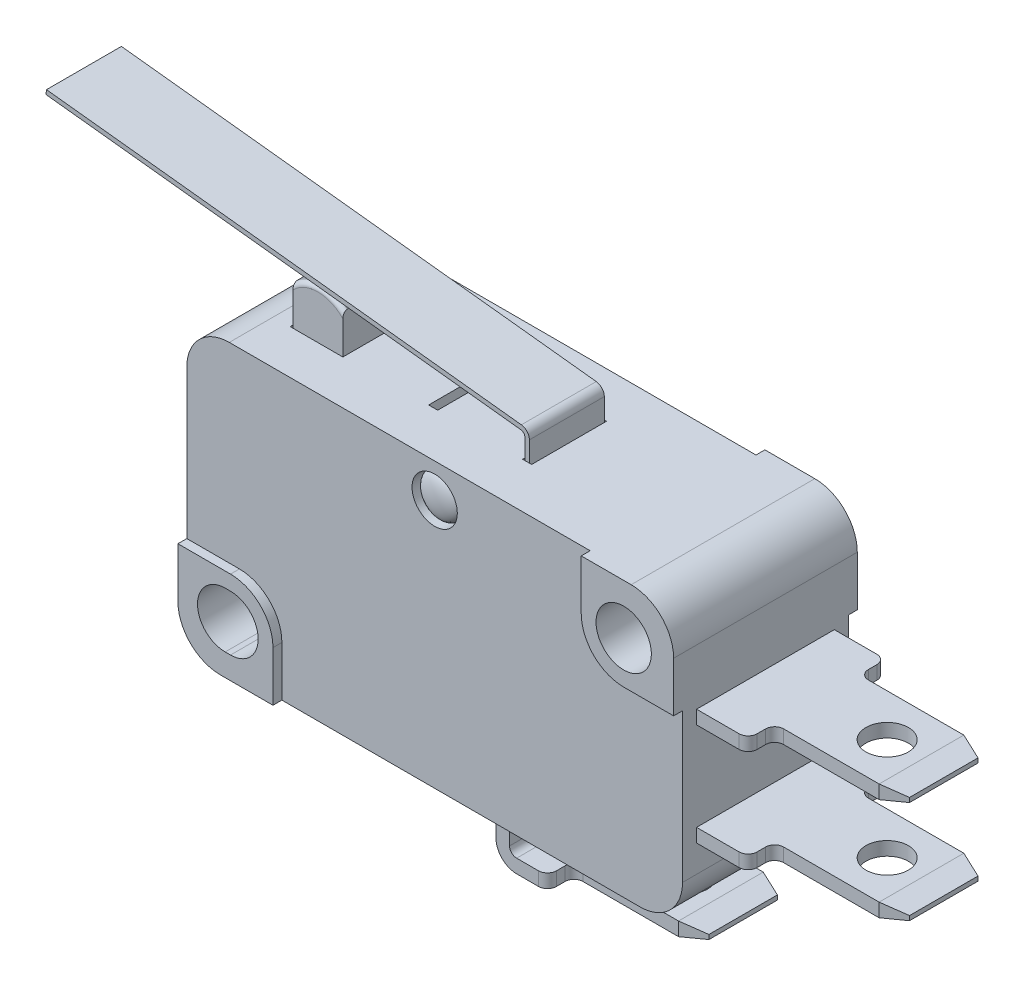
from build123d import *

# Parameters (mm, degrees)
BOSS_EXTRUDE1_DEPTH             = 5.15
BOSS_EXTRUDE1_DEPTH_BACK        = 5.15
SKETCH3_R                       = 1.55
CUT_EXTRUDE1_START              = 5.15
CUT_EXTRUDE1_DEPTH              = 0.5
CUT_EXTRUDE5_DEPTH              = 2.1
CUT_EXTRUDE5_DEPTH_BACK         = 2.1
SKETCH10_W                      = 0.508
SKETCH10_H                      = 1.5875
SKETCH8_W                       = 2.9524
SKETCH8_H                       = 0.396875
CUT_EXTRUDE4_DEPTH              = 2.1762
BOSS_EXTRUDE3_DEPTH             = 2.1
BOSS_EXTRUDE3_DEPTH_BACK        = 2.1
BOSS_EXTRUDE2_DEPTH             = 3.8625
BOSS_EXTRUDE2_2_DEPTH           = 3.8625
BOSS_EXTRUDE2_3_DEPTH           = 3.8625
BOSS_EXTRUDE9_REACH             = 28.644
BOSS_EXTRUDE9_DIRECTION_2_REACH = 28.644
FILLET5_R                       = 0.254
CUT_EXTRUDE2_DEPTH              = 28.871691861
CUT_EXTRUDE2_DEPTH_BACK         = 28.871691861
SKETCH6_OUTSIDE_W               = 61.146
SKETCH6_OUTSIDE_H               = 23.198
SKETCH6_OUTSIDE_R               = 1.190625
SKETCH7_OUTSIDE_W               = 61.146
SKETCH7_OUTSIDE_H               = 23.198
SKETCH7_OUTSIDE_R               = 1.190625
CUT_EXTRUDE3_DEPTH              = 28.871691861
SKETCH25_R                      = 1.27
CUT_EXTRUDE6_DEPTH              = 1.27
SKETCH26_R                      = 1.2065
BOSS_EXTRUDE10_DEPTH            = 0.762
DOME1_FACE_RADIUS               = 1.2065
DOME1_HEIGHT                    = 0.508


with BuildPart() as part:
    # Sketch3 → Boss-Extrude1 (new, two sides: drawn at the far end of the back side and taken through both)
    with BuildSketch(Plane.XY.offset(-BOSS_EXTRUDE1_DEPTH_BACK)):
        with BuildLine():
            Line((-11.51875, 7.95), (11.51875, 7.95))
            ThreePointArc((11.51875, 7.95), (13.202548023, 7.252548023), (13.9, 5.56875))
            Line((13.9, 5.56875), (13.9, -5.56875))
            ThreePointArc((13.9, -5.56875), (13.202548023, -7.252548023), (11.51875, -7.95))
            Line((11.51875, -7.95), (-11.51875, -7.95))
            ThreePointArc((-11.51875, -7.95), (-13.202548023, -7.252548023), (-13.9, -5.56875))
            Line((-13.9, -5.56875), (-13.9, 5.56875))
            ThreePointArc((-13.9, 5.56875), (-13.202548023, 7.252548023), (-11.51875, 7.95))
        make_face()
        with Locations(Location((11.1, 5.15, 0), (0, 0, 180))):
            Circle(SKETCH3_R, mode=Mode.SUBTRACT)
        with BuildLine():
            Line((-11.25, -3.6), (-10.95, -3.6))
            ThreePointArc((-10.95, -3.6), (-9.4, -5.15), (-10.95, -6.7))
            Line((-10.95, -6.7), (-11.25, -6.7))
            ThreePointArc((-11.25, -6.7), (-12.8, -5.15), (-11.25, -3.6))
        make_face(mode=Mode.SUBTRACT)
    extrude(amount=BOSS_EXTRUDE1_DEPTH + BOSS_EXTRUDE1_DEPTH_BACK)

    # Sketch4 → Cut-Extrude1 (cut)
    with BuildSketch(Plane.XY.offset(CUT_EXTRUDE1_START)):
        with BuildLine():
            Line((-13.9, -2.76875), (-10.95, -2.76875))
            ThreePointArc((-10.95, -2.76875), (-9.266201977, -3.466201977), (-8.56875, -5.15))
            Line((-8.56875, -5.15), (-8.56875, -7.95))
            Line((-8.56875, -7.95), (13.9, -7.95))
            Line((13.9, -7.95), (13.9, 2.76875))
            Line((13.9, 2.76875), (11.1, 2.76875))
            ThreePointArc((11.1, 2.76875), (9.416201977, 3.466201977), (8.71875, 5.15))
            Line((8.71875, 5.15), (8.71875, 7.95))
            Line((8.71875, 7.95), (-13.9, 7.95))
            Line((-13.9, 7.95), (-13.9, -2.76875))
        make_face()
    cut_extrude1 = extrude(amount=-CUT_EXTRUDE1_DEPTH, mode=Mode.SUBTRACT)

    # Mirror1: Cut-Extrude1 across plane
    add(cut_extrude1.mirror(Plane.XY), mode=Mode.SUBTRACT)

    # Sketch10 → Cut-Extrude5 (cut, two sides: drawn at the far end of the back side and taken through both)
    with BuildSketch(Plane.XY.offset(-CUT_EXTRUDE5_DEPTH_BACK)):
        with Locations((-2.63525, 7.15625)):
            Rectangle(SKETCH10_W, SKETCH10_H)
        with Locations((2.63525, 7.15625)):
            Rectangle(SKETCH10_W, SKETCH10_H)
    extrude(amount=CUT_EXTRUDE5_DEPTH + CUT_EXTRUDE5_DEPTH_BACK, mode=Mode.SUBTRACT)

    # Sketch8 → Cut-Extrude4 (cut, symmetric)
    with BuildSketch(Plane.XY):
        with Locations((-9.1, 7.7515625)):
            Rectangle(SKETCH8_W, SKETCH8_H)
    extrude(amount=CUT_EXTRUDE4_DEPTH, both=True, mode=Mode.SUBTRACT)

    # Sketch25 → Cut-Extrude6 (cut)
    with BuildSketch(Plane.XY.offset(4.65)):
        with Locations((0, 6.045)):
            Circle(SKETCH25_R)
    cut_extrude6 = extrude(amount=-CUT_EXTRUDE6_DEPTH, mode=Mode.SUBTRACT)

    # Mirror2: Cut-Extrude6 across plane
    add(cut_extrude6.mirror(Plane.XY), mode=Mode.SUBTRACT)


with BuildPart() as body_2:
    # Sketch9 → Boss-Extrude3 (new, two sides: drawn at the far end of the back side and taken through both)
    with BuildSketch(Plane.XY.offset(-BOSS_EXTRUDE3_DEPTH_BACK)):
        with BuildLine():
            Line((-10.5, 10.079506749), (-10.5, 7.553125))
            Line((-10.5, 7.553125), (-7.7, 7.553125))
            Line((-7.7, 7.553125), (-7.7, 10.079506749))
            ThreePointArc((-7.7, 10.079506749), (-9.1, 10.587506749), (-10.5, 10.079506749))
        make_face()
    extrude(amount=BOSS_EXTRUDE3_DEPTH + BOSS_EXTRUDE3_DEPTH_BACK)


with BuildPart() as body_3:
    # Sketch5 → Boss-Extrude2 (new, symmetric)
    with BuildSketch(Plane.XY):
        Polygon((13.9, 1.688), (13.9, 2.45), (22.65, 2.45), (23.9, 2.194), (23.9, 1.944), (22.65, 1.688), align=None)
    extrude(amount=BOSS_EXTRUDE2_DEPTH, both=True)


with BuildPart() as body_4:
    # Sketch5 → Boss-Extrude2 2 (new, symmetric)
    with BuildSketch(Plane.XY):
        Polygon((13.9, -3.288), (22.65, -3.288), (23.9, -3.544), (23.9, -3.794), (22.65, -4.05), (13.9, -4.05), align=None)
    extrude(amount=BOSS_EXTRUDE2_2_DEPTH, both=True)


with BuildPart() as body_5:
    # Sketch5 → Boss-Extrude2 3 (new, symmetric)
    with BuildSketch(Plane.XY):
        with BuildLine():
            Line((2.65, -7.95), (2.65, -9.433125))
            ThreePointArc((2.65, -9.433125), (2.989426629, -10.252573371), (3.808875, -10.592))
            Line((3.808875, -10.592), (11.4, -10.592))
            Line((11.4, -10.592), (12.65, -10.336))
            Line((12.65, -10.336), (12.65, -10.086))
            Line((12.65, -10.086), (11.4, -9.83))
            Line((11.4, -9.83), (3.808875, -9.83))
            ThreePointArc((3.808875, -9.83), (3.528241996, -9.713758004), (3.412, -9.433125))
            Line((3.412, -9.433125), (3.412, -7.95))
            Line((3.412, -7.95), (2.65, -7.95))
        make_face()
    extrude(amount=BOSS_EXTRUDE2_3_DEPTH, both=True)

    # Sketch7 outside → Cut-Extrude3 (cut, through all)
    # profile 1 of 2: a face of its own
    with BuildSketch(Plane(origin=(0, 0, 0), x_dir=(1, 0, 0), z_dir=(0, 1, 0))):
        with Locations((-0.224, 0)):
            Rectangle(SKETCH7_OUTSIDE_W, SKETCH7_OUTSIDE_H)
        with BuildLine():
            Line((2.65, 3.8625), (2.65, -3.8625))
            Line((2.65, -3.8625), (5.03125, -3.8625))
            ThreePointArc((5.03125, -3.8625), (5.390460245, -3.713710245), (5.53925, -3.3545))
            Line((5.53925, -3.3545), (5.53925, -2.8829))
            ThreePointArc((5.53925, -2.8829), (5.688039755, -2.523689755), (6.04725, -2.3749))
            Line((6.04725, -2.3749), (11.4, -2.3749))
            Line((11.4, -2.3749), (12.65, -1.919937207))
            Line((12.65, -1.919937207), (12.65, 1.919937207))
            Line((12.65, 1.919937207), (11.4, 2.3749))
            Line((11.4, 2.3749), (6.04725, 2.3749))
            ThreePointArc((6.04725, 2.3749), (5.688039755, 2.523689755), (5.53925, 2.8829))
            Line((5.53925, 2.8829), (5.53925, 3.3545))
            ThreePointArc((5.53925, 3.3545), (5.390460245, 3.713710245), (5.03125, 3.8625))
            Line((5.03125, 3.8625), (2.65, 3.8625))
        make_face(mode=Mode.SUBTRACT)
    # profile 2 of 2: a face of its own
    with BuildSketch(Plane(origin=(0, 0, 0), x_dir=(1, 0, 0), z_dir=(0, 1, 0))):
        with Locations(Location((9.475, 0, 0), (0, 0, 270))):
            Circle(SKETCH7_OUTSIDE_R)
    extrude(amount=-CUT_EXTRUDE3_DEPTH, mode=Mode.SUBTRACT)


with BuildPart() as body_6:

    # Boss-Extrude9: up to this face of the body (flat: up to its plane)
    boss_extrude9_end = Plane(body_2.part.faces().sort_by_distance((-9.1, 8.993855519, 2.1))[0])
    # Sketch23 → Boss-Extrude9 (new, up to the picked face)
    with BuildSketch(Plane.XY, mode=Mode.PRIVATE) as boss_extrude9_sk1:
        with BuildLine():
            Line((2.282338846, 9.334484128), (-24.34761194, 12.297557894))
            Line((-24.34761194, 12.297557894), (-24.319523094, 12.55))
            Line((-24.319523094, 12.55), (2.310427692, 9.586926234))
            ThreePointArc((2.310427692, 9.586926234), (2.632801362, 9.420808707), (2.76225, 9.082042023))
            Line((2.76225, 9.082042023), (2.76225, 6.3625))
            Line((2.76225, 6.3625), (2.50825, 6.3625))
            Line((2.50825, 6.3625), (2.50825, 9.082042023))
            ThreePointArc((2.50825, 9.082042023), (2.443525681, 9.251425365), (2.282338846, 9.334484128))
        make_face()
    boss_extrude9_tool1 = split(extrude(boss_extrude9_sk1.sketch, amount=BOSS_EXTRUDE9_REACH, mode=Mode.PRIVATE), bisect_by=boss_extrude9_end, keep=Keep.BOTH, mode=Mode.PRIVATE)
    add(boss_extrude9_tool1.solids().sort_by(Axis((2.464247, 9.269969, 0), (0, 0, 1)))[0])


    # Boss-Extrude9 direction 2: up to this face of the body (flat: up to its plane)
    boss_extrude9_direction_2_end = Plane(body_2.part.faces().sort_by_distance((-9.1, 8.993855519, -2.1))[0])
    # Sketch23 → Boss-Extrude9 direction 2 (add, up to the picked face)
    with BuildSketch(Plane.XY, mode=Mode.PRIVATE) as boss_extrude9_direction_2_sk1:
        with BuildLine():
            Line((2.282338846, 9.334484128), (-24.34761194, 12.297557894))
            Line((-24.34761194, 12.297557894), (-24.319523094, 12.55))
            Line((-24.319523094, 12.55), (2.310427692, 9.586926234))
            ThreePointArc((2.310427692, 9.586926234), (2.632801362, 9.420808707), (2.76225, 9.082042023))
            Line((2.76225, 9.082042023), (2.76225, 6.3625))
            Line((2.76225, 6.3625), (2.50825, 6.3625))
            Line((2.50825, 6.3625), (2.50825, 9.082042023))
            ThreePointArc((2.50825, 9.082042023), (2.443525681, 9.251425365), (2.282338846, 9.334484128))
        make_face()
    boss_extrude9_direction_2_tool1 = split(extrude(boss_extrude9_direction_2_sk1.sketch, amount=-BOSS_EXTRUDE9_DIRECTION_2_REACH, mode=Mode.PRIVATE), bisect_by=boss_extrude9_direction_2_end, keep=Keep.BOTH, mode=Mode.PRIVATE)
    add(boss_extrude9_direction_2_tool1.solids().sort_by(Axis((2.464247, 9.269969, 0), (0, 0, -1)))[0])


with BuildPart() as body_2_1:
    add(body_2.part)

    # Fillet5
    fillet5_edges = [body_2_1.edges().sort_by_distance(p)[0] for p in [
        (-9.1, 10.587506749, -2.1),
        (-9.1, 10.587506749, 2.1),
    ]]
    fillet(fillet5_edges, radius=FILLET5_R)


with BuildPart() as cut_extrude2_tool:
    # Sketch6 outside → Cut-Extrude2 (new, two sides: drawn at the far end of the back side and taken through both)
    # profile 1 of 2: a face of its own
    with BuildSketch(Plane(origin=(0, 0, 0), x_dir=(1, 0, 0), z_dir=(0, 1, 0)).offset(-CUT_EXTRUDE2_DEPTH_BACK)):
        with Locations((-0.224, 0)):
            Rectangle(SKETCH6_OUTSIDE_W, SKETCH6_OUTSIDE_H)
        with BuildLine():
            Line((13.9, 3.8625), (13.9, -3.8625))
            Line((13.9, -3.8625), (16.28125, -3.8625))
            ThreePointArc((16.28125, -3.8625), (16.640460245, -3.713710245), (16.78925, -3.3545))
            Line((16.78925, -3.3545), (16.78925, -2.8829))
            ThreePointArc((16.78925, -2.8829), (16.938039755, -2.523689755), (17.29725, -2.3749))
            Line((17.29725, -2.3749), (22.65, -2.3749))
            Line((22.65, -2.3749), (23.9, -1.919937207))
            Line((23.9, -1.919937207), (23.9, 1.919937207))
            Line((23.9, 1.919937207), (22.65, 2.3749))
            Line((22.65, 2.3749), (17.29725, 2.3749))
            ThreePointArc((17.29725, 2.3749), (16.938039755, 2.523689755), (16.78925, 2.8829))
            Line((16.78925, 2.8829), (16.78925, 3.3545))
            ThreePointArc((16.78925, 3.3545), (16.640460245, 3.713710245), (16.28125, 3.8625))
            Line((16.28125, 3.8625), (13.9, 3.8625))
        make_face(mode=Mode.SUBTRACT)
    # profile 2 of 2: a face of its own
    with BuildSketch(Plane(origin=(0, 0, 0), x_dir=(1, 0, 0), z_dir=(0, 1, 0)).offset(-CUT_EXTRUDE2_DEPTH_BACK)):
        with Locations(Location((20.725, 0, 0), (0, 0, 270))):
            Circle(SKETCH6_OUTSIDE_R)
    extrude(amount=CUT_EXTRUDE2_DEPTH + CUT_EXTRUDE2_DEPTH_BACK)


with BuildPart() as body_4_1:
    add(body_4.part)

    # Cut-Extrude2: cut by cut_extrude2_tool
    add(cut_extrude2_tool.part, mode=Mode.SUBTRACT)


with BuildPart() as body_3_1:
    add(body_3.part)

    # Cut-Extrude2: cut by cut_extrude2_tool
    add(cut_extrude2_tool.part, mode=Mode.SUBTRACT)


with BuildPart() as body_7:
    # Sketch26 → Boss-Extrude10 (new body)
    with BuildSketch(Plane.XY.offset(3.38)):
        with Locations(Location((0, 6.045, 0), (0, 0, 180))):
            Circle(SKETCH26_R)
    extrude(amount=BOSS_EXTRUDE10_DEPTH)

    # Dome1: an elliptical dome of height H over a round flat face of radius A is half a spheroid: the quarter ellipse of half axes A and H revolved about the face's axis
    with BuildSketch(Plane((0, 6.045, 4.142), x_dir=(0, 1, 0), z_dir=(1, 0, 0)), mode=Mode.PRIVATE) as dome1_quarter:
        Ellipse(DOME1_FACE_RADIUS, DOME1_HEIGHT)
        Rectangle(DOME1_FACE_RADIUS, DOME1_HEIGHT, align=(Align.MIN, Align.MIN), mode=Mode.INTERSECT)
    revolve(dome1_quarter.sketch, axis=Axis((0, 6.045, 4.142), (0, 0, 1)))


with BuildPart() as body_8:
    # Mirror3: mirrored copy
    add(body_7.part.mirror(Plane.XY))


solid = Compound([part.part, body_5.part, body_6.part, body_2_1.part, body_4_1.part, body_3_1.part, body_7.part, body_8.part])
